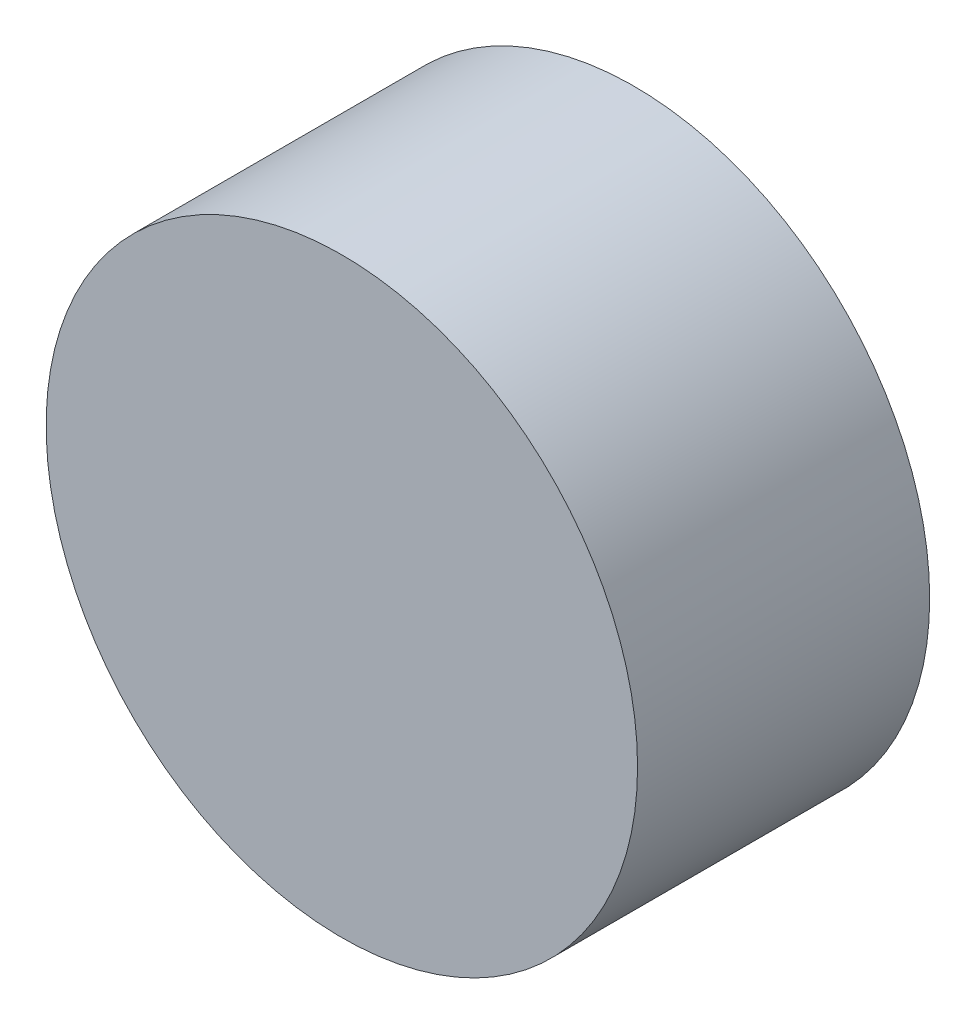
from build123d import *

# Parameters (mm, degrees)
SKETCH1_R           = 10.123456789
BOSS_EXTRUDE1_DEPTH = 10


with BuildPart() as part:
    # Sketch1 → Boss-Extrude1 (new body)
    with BuildSketch(Plane.XY):
        Circle(SKETCH1_R)
    extrude(amount=BOSS_EXTRUDE1_DEPTH)


solid = part.part
